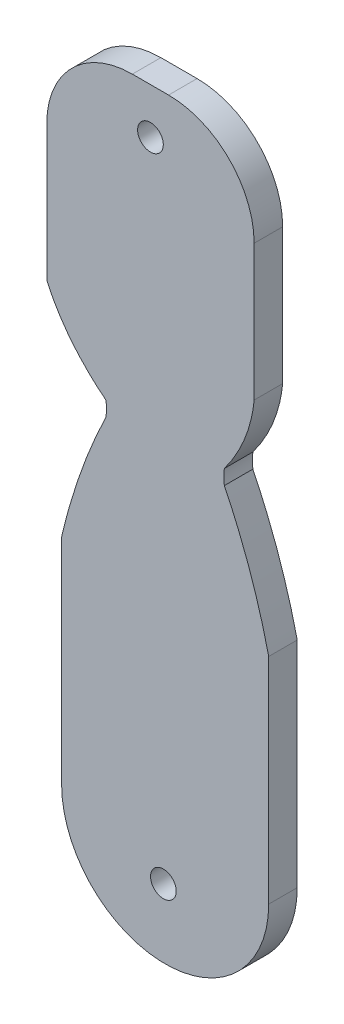
from build123d import *

# Parameters (mm, degrees)
RESSALTO_EXTRUS_O1_DEPTH = 5
ESBO_O2_R                = 2.25
CORTE_EXTRUS_O1_DEPTH    = 117.030017788
FILETE1_R                = 15


with BuildPart() as part:
    # Esboço1 → Ressalto-extrusão1 (new body)
    with BuildSketch(Plane.XY):
        with BuildLine():
            Line((-18.15, 0), (-18.15, 37.6))
            add(Edge.make_bspline(
                [(-18.15, 37.6), (-15.473970767, 49.184313893), (-10.375, 59.65)],
                knots=[0, 0, 0, 0.611079356, 0.611079356, 0.611079356], degree=2))
            add(Edge.make_bspline(
                [(-10.375, 59.65), (-10.182305069, 61.008012224), (-10.375, 62.25)],
                knots=[0, 0, 0, 0.268489531, 0.268489531, 0.268489531], degree=2))
            add(Edge.make_bspline(
                [(-10.375, 62.25), (-17.376864496, 67.749205026), (-20.75, 75.25)],
                knots=[0, 0, 0, 0.738516148, 0.738516148, 0.738516148], degree=2))
            Line((-20.75, 75.25), (-20.75, 114.05))
            Line((-20.75, 114.05), (15.6, 114.05))
            Line((15.6, 114.05), (15.6, 75.25))
            add(Edge.make_bspline(
                [(10.375, 62.25), (14.919065783, 68.376354775), (15.6, 75.25)],
                knots=[0, 0, 0, 0.739355324, 0.739355324, 0.739355324], degree=2))
            add(Edge.make_bspline(
                [(10.375, 59.65), (10.182305069, 61.008012224), (10.375, 62.25)],
                knots=[0, 0, 0, 0.268489531, 0.268489531, 0.268489531], degree=2))
            add(Edge.make_bspline(
                [(18.15, 37.6), (15.473970767, 49.184313893), (10.375, 59.65)],
                knots=[0, 0, 0, 0.611079356, 0.611079356, 0.611079356], degree=2))
            Line((18.15, 37.6), (18.15, 0))
            ThreePointArc((18.15, 0), (0, -18.15), (-18.15, 0))
        make_face()
    extrude(amount=RESSALTO_EXTRUS_O1_DEPTH)

    # Esboço2 → Corte-extrusão1 (cut, through all)
    with BuildSketch(Plane.XY.offset(5)):
        with Locations((-0.31, -6.15)):
            Circle(ESBO_O2_R)
        with Locations((-2.575, 106.05)):
            Circle(ESBO_O2_R)
    extrude(amount=-CORTE_EXTRUS_O1_DEPTH, mode=Mode.SUBTRACT)

    # Filete1
    filete1_edges = [part.edges().sort_by_distance(p)[0] for p in [
        (-20.75, 114.05, 2.5),
        (15.6, 114.05, 2.5),
    ]]
    fillet(filete1_edges, radius=FILETE1_R)


solid = part.part
